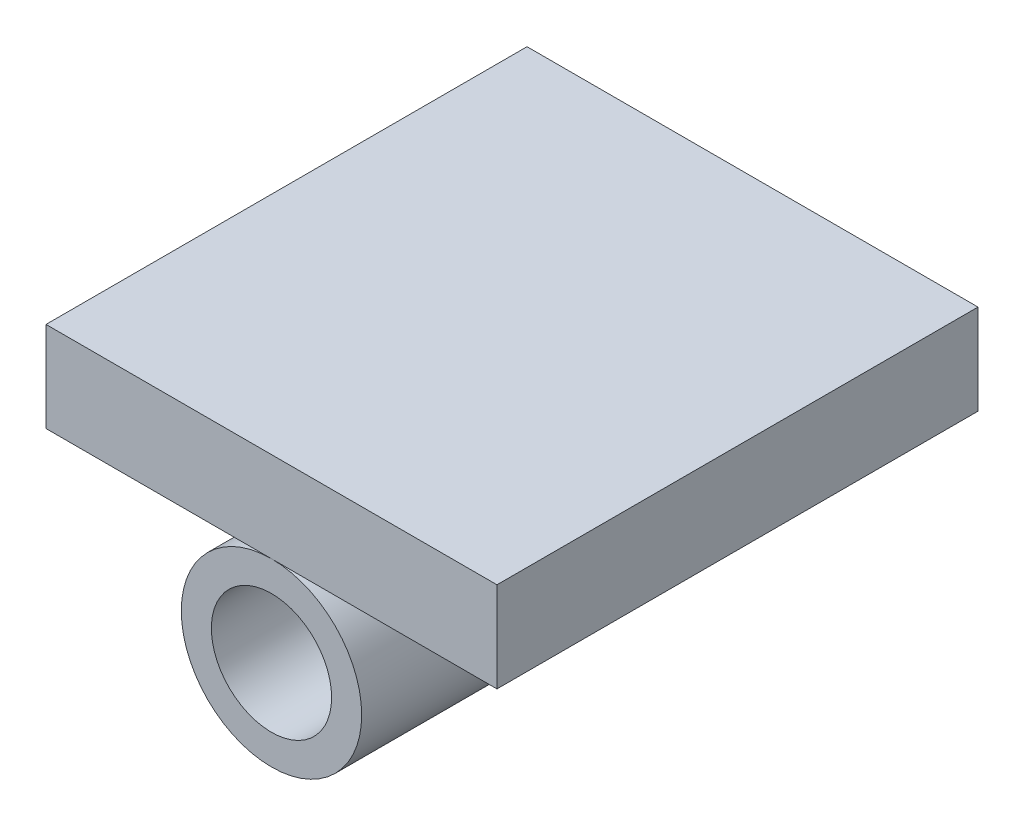
from build123d import *

# Parameters (mm, degrees)
SKETCH1_R           = 30
SKETCH1_R_2         = 20
BOSS_EXTRUDE1_DEPTH = 80
SKETCH2_W           = 150
SKETCH2_H           = 160
BOSS_EXTRUDE2_DEPTH = 30


with BuildPart() as part:
    # Sketch1 → Boss-Extrude1 (new, symmetric)
    with BuildSketch(Plane.XY):
        Circle(SKETCH1_R)
        Circle(SKETCH1_R_2, mode=Mode.SUBTRACT)
    extrude(amount=BOSS_EXTRUDE1_DEPTH, both=True)


with BuildPart() as body_2:
    # Sketch2 → Boss-Extrude2 (new body)
    with BuildSketch(Plane(origin=(0, 30, 0), x_dir=(1, 0, 0), z_dir=(0, 1, 0))):
        Rectangle(SKETCH2_W, SKETCH2_H)
    extrude(amount=BOSS_EXTRUDE2_DEPTH)


solid = Compound([part.part, body_2.part])
